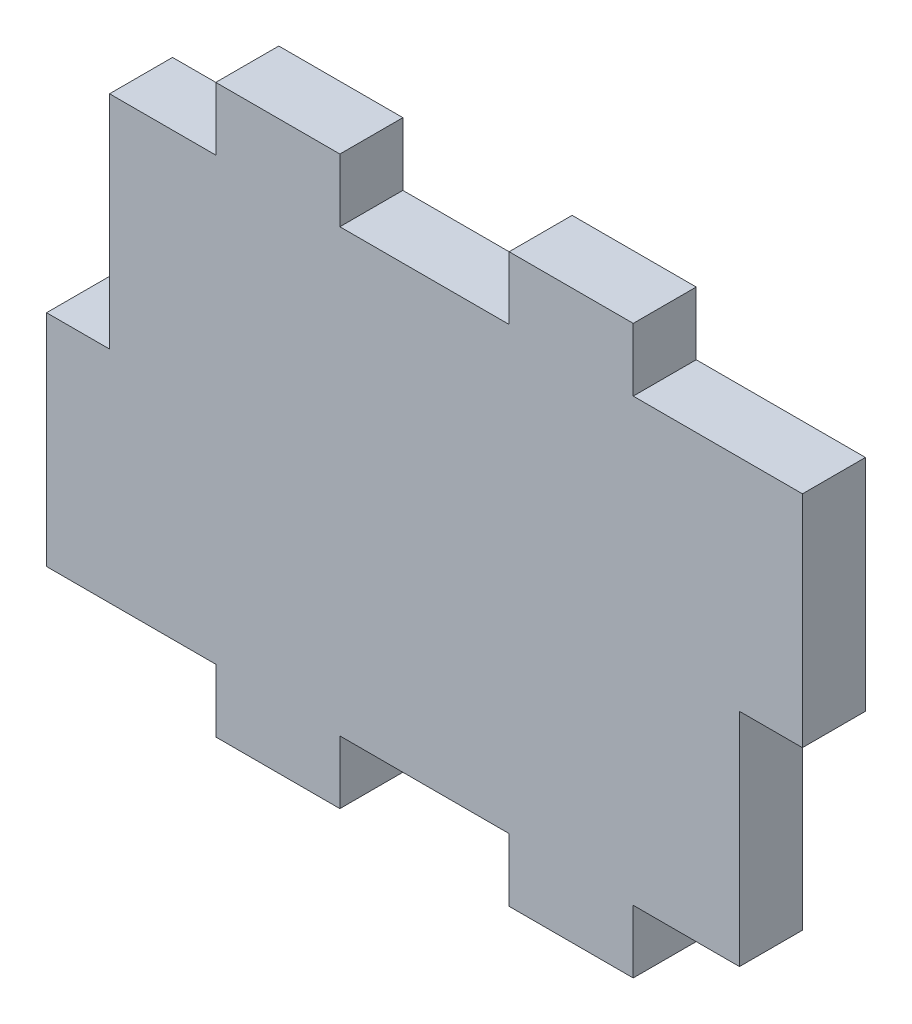
from build123d import *

# Parameters (mm, degrees)
SKETCH2_W           = 50
SKETCH2_H           = 35
SKETCH2_W_2         = 5
SKETCH2_H_2         = 17.45
SKETCH2_W_3         = 9.85
SKETCH2_H_3         = 5
BOSS_EXTRUDE1_DEPTH = 5


with BuildPart() as part:
    # Sketch2 → Boss-Extrude1 (new body)
    with BuildSketch(Plane.XY):
        Rectangle(SKETCH2_W, SKETCH2_H)
        with Locations((-27.5, -8.775)):
            Rectangle(SKETCH2_W_2, SKETCH2_H_2)
        with Locations((-11.641666667, 20)):
            Rectangle(SKETCH2_W_3, SKETCH2_H_3)
        with Locations((11.641666667, 20)):
            Rectangle(SKETCH2_W_3, SKETCH2_H_3)
        with Locations((27.5, 8.775)):
            Rectangle(SKETCH2_W_2, SKETCH2_H_2)
        with Locations((11.641666667, -20)):
            Rectangle(SKETCH2_W_3, SKETCH2_H_3)
        with Locations((-11.641666667, -20)):
            Rectangle(SKETCH2_W_3, SKETCH2_H_3)
    extrude(amount=BOSS_EXTRUDE1_DEPTH)


solid = part.part
